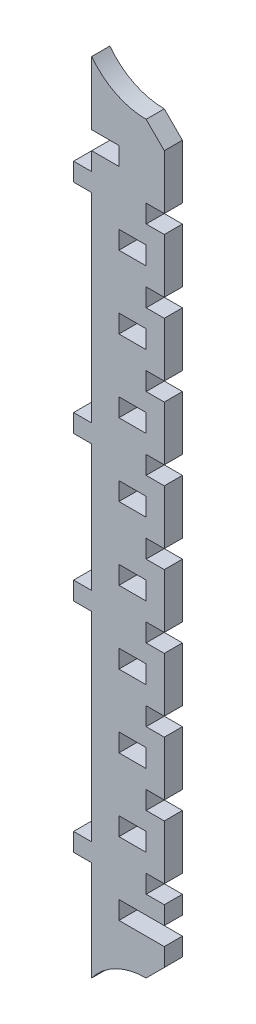
from build123d import *

# Parameters (mm, degrees)
SKETCH1_W           = 4.5
SKETCH1_H           = 3
BOSS_EXTRUDE1_DEPTH = 3


with BuildPart() as part:
    # Sketch1 → Boss-Extrude1 (new body)
    with BuildSketch(Plane.XY):
        with BuildLine():
            Line((18, 157.5), (15, 157.5))
            Line((15, 157.5), (15, 154.5))
            Line((15, 154.5), (18, 154.5))
            Line((18, 154.5), (18, 145.5))
            Line((18, 145.5), (15, 145.5))
            Line((15, 145.5), (15, 142.5))
            Line((15, 142.5), (18, 142.5))
            Line((18, 142.5), (18, 133.5))
            Line((18, 133.5), (15, 133.5))
            Line((15, 133.5), (15, 130.5))
            Line((15, 130.5), (18, 130.5))
            Line((18, 130.5), (18, 121.5))
            Line((18, 121.5), (15, 121.5))
            Line((15, 121.5), (15, 118.5))
            Line((15, 118.5), (18, 118.5))
            Line((18, 118.5), (18, 109.5))
            Line((18, 109.5), (15, 109.5))
            Line((15, 109.5), (15, 106.5))
            Line((15, 106.5), (18, 106.5))
            Line((18, 106.5), (18, 97.5))
            Line((18, 97.5), (15, 97.5))
            Line((15, 97.5), (15, 94.5))
            Line((15, 94.5), (18, 94.5))
            Line((18, 94.5), (18, 85.5))
            Line((18, 85.5), (15, 85.5))
            Line((15, 85.5), (15, 82.5))
            Line((15, 82.5), (18, 82.5))
            Line((18, 82.5), (18, 73.5))
            Line((18, 73.5), (15, 73.5))
            Line((15, 73.5), (15, 70.5))
            Line((15, 70.5), (18, 70.5))
            Line((18, 70.5), (18, 67.5))
            Line((18, 67.5), (10.5, 67.5))
            Line((10.5, 67.5), (10.5, 64.5))
            Line((10.5, 64.5), (18, 64.5))
            Line((18, 64.5), (18, 61.5))
            Line((18, 61.5), (15, 58.5))
            ThreePointArc((15, 58.5), (9.968847051, 57.312305899), (6, 54))
            Line((6, 54), (6, 70.5))
            Line((6, 70.5), (3, 70.5))
            Line((3, 70.5), (3, 73.5))
            Line((3, 73.5), (6, 73.5))
            Line((6, 73.5), (6, 106.5))
            Line((6, 106.5), (3, 106.5))
            Line((3, 106.5), (3, 109.5))
            Line((3, 109.5), (6, 109.5))
            Line((6, 109.5), (6, 130.5))
            Line((6, 130.5), (3, 130.5))
            Line((3, 130.5), (3, 133.5))
            Line((3, 133.5), (6, 133.5))
            Line((6, 133.5), (6, 166.5))
            Line((6, 166.5), (3, 166.5))
            Line((3, 166.5), (3, 169.5))
            Line((3, 169.5), (6, 169.5))
            Line((6, 169.5), (6, 172.5))
            Line((6, 172.5), (10.5, 172.5))
            Line((10.5, 172.5), (10.5, 175.5))
            Line((10.5, 175.5), (6, 175.5))
            Line((6, 175.5), (6, 186))
            ThreePointArc((6, 186), (9.968847051, 182.687694101), (15, 181.5))
            Line((15, 181.5), (18, 178.5))
            Line((18, 178.5), (18, 169.5))
            Line((18, 169.5), (15, 169.5))
            Line((15, 169.5), (15, 166.5))
            Line((15, 166.5), (18, 166.5))
            Line((18, 166.5), (18, 157.5))
        make_face()
        with Locations((12.75, 78)):
            Rectangle(SKETCH1_W, SKETCH1_H, mode=Mode.SUBTRACT)
        with Locations((12.75, 162)):
            Rectangle(SKETCH1_W, SKETCH1_H, mode=Mode.SUBTRACT)
        with Locations((12.75, 150)):
            Rectangle(SKETCH1_W, SKETCH1_H, mode=Mode.SUBTRACT)
        with Locations((12.75, 138)):
            Rectangle(SKETCH1_W, SKETCH1_H, mode=Mode.SUBTRACT)
        with Locations((12.75, 126)):
            Rectangle(SKETCH1_W, SKETCH1_H, mode=Mode.SUBTRACT)
        with Locations((12.75, 114)):
            Rectangle(SKETCH1_W, SKETCH1_H, mode=Mode.SUBTRACT)
        with Locations((12.75, 102)):
            Rectangle(SKETCH1_W, SKETCH1_H, mode=Mode.SUBTRACT)
        with Locations((12.75, 90)):
            Rectangle(SKETCH1_W, SKETCH1_H, mode=Mode.SUBTRACT)
    extrude(amount=BOSS_EXTRUDE1_DEPTH)


solid = part.part
